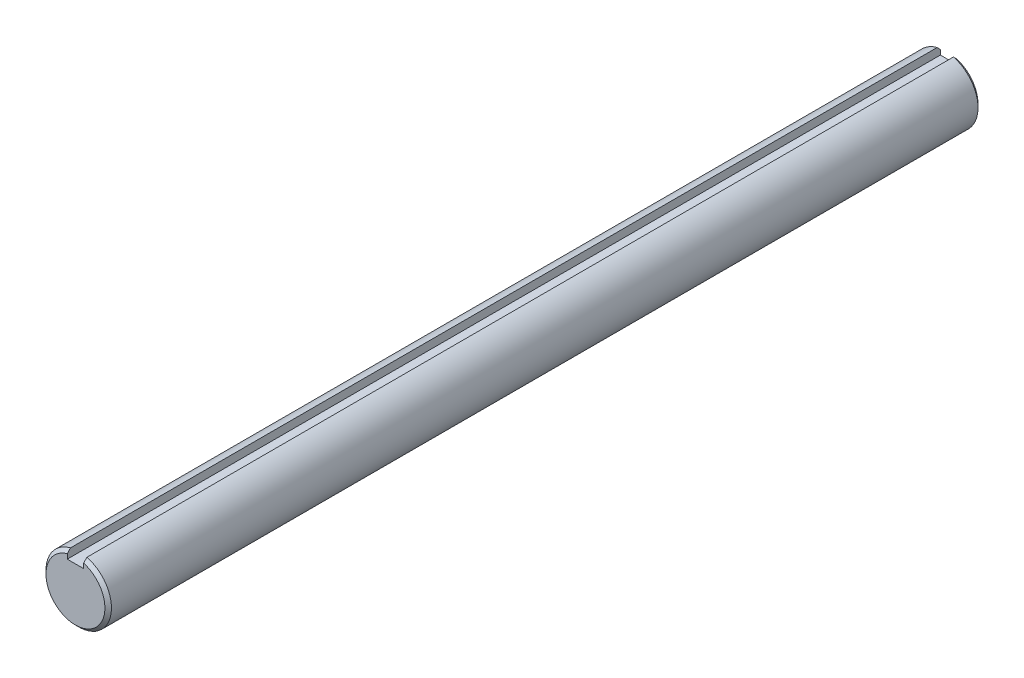
from build123d import *

# Parameters (mm, degrees)
BOSS_EXTRUDE2_DEPTH      = 127
BOSS_EXTRUDE2_DEPTH_BACK = 127
SKETCH3_R                = 9.525
CUT_EXTRUDE5_DEPTH       = 128.712377043
CUT_EXTRUDE5_DEPTH_BACK  = 128.712377043
SKETCH10_W               = 4.7625
SKETCH10_H               = 2.683708407
CHAMFER1_SIZE            = 0.9525


with BuildPart() as part:
    # Sketch3 → Boss-Extrude2 (new, two sides: drawn at the far end of the back side and taken through both)
    with BuildSketch(Plane.XY.offset(-BOSS_EXTRUDE2_DEPTH_BACK)):
        Circle(SKETCH3_R)
    extrude(amount=BOSS_EXTRUDE2_DEPTH + BOSS_EXTRUDE2_DEPTH_BACK)

    # Sketch10 → Cut-Extrude5 (cut, two sides: drawn at the far end of the back side and taken through both)
    with BuildSketch(Plane.XY.offset(-CUT_EXTRUDE5_DEPTH_BACK)):
        with Locations((0, 8.183145796)):
            Rectangle(SKETCH10_W, SKETCH10_H)
    extrude(amount=CUT_EXTRUDE5_DEPTH + CUT_EXTRUDE5_DEPTH_BACK, mode=Mode.SUBTRACT)

    # Chamfer1
    chamfer1_edges = [part.edges().sort_by_distance(p)[0] for p in [
        (0, -9.525, 127),
        (0, -9.525, -127),
    ]]
    chamfer(chamfer1_edges, length=CHAMFER1_SIZE)


solid = part.part
